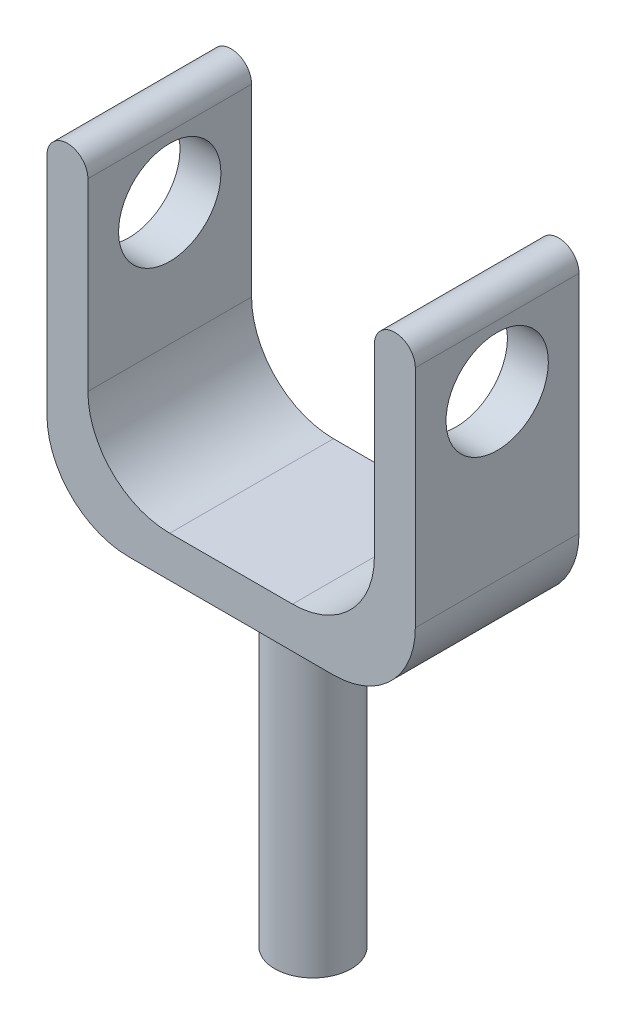
from build123d import *

# Parameters (mm, degrees)
BOSS_EXTRUDE1_DEPTH     = 20
SKETCH2_R               = 9.3485
BOSS_EXTRUDE2_DEPTH     = 80
FILLET1_R               = 20
CUT_EXTRUDE1_DEPTH      = 126.39936204
CUT_EXTRUDE1_DEPTH_BACK = 126.39936204
SKETCH3_R               = 12.5
SCALE1_SCALE            = 0.5


with BuildPart() as part:
    # Sketch1 → Boss-Extrude1 (new, symmetric)
    with BuildSketch(Plane.XY):
        with BuildLine():
            Line((35, 5), (35, 70))
            ThreePointArc((35, 70), (40, 75), (45, 70))
            Line((45, 70), (45, -5))
            Line((45, -5), (-45, -5))
            Line((-45, -5), (-45, 70))
            ThreePointArc((-45, 70), (-40, 75), (-35, 70))
            Line((-35, 70), (-35, 5))
            Line((-35, 5), (35, 5))
        make_face()
    extrude(amount=BOSS_EXTRUDE1_DEPTH, both=True)

    # Sketch2 → Boss-Extrude2 (add)
    with BuildSketch(Plane.XZ.offset(5)):
        with Locations(Location((0, 0, 0), (0, 0, 270))):
            Circle(SKETCH2_R)
    extrude(amount=BOSS_EXTRUDE2_DEPTH)

    # Fillet1
    fillet1_edges = [part.edges().sort_by_distance(p)[0] for p in [
        (35, 5, 0),
        (45, -5, 0),
        (-45, -5, 0),
        (-35, 5, 0),
    ]]
    fillet(fillet1_edges, radius=FILLET1_R)

    # Sketch3 → Cut-Extrude1 (cut, two sides: drawn at the far end of the back side and taken through both)
    with BuildSketch(Plane(origin=(45, 0, 0), x_dir=(0, 0, -1), z_dir=(1, 0, 0)).offset(-CUT_EXTRUDE1_DEPTH_BACK)):
        with Locations(Location((0, 55, 0), (0, 0, 90))):
            Circle(SKETCH3_R)
    extrude(amount=CUT_EXTRUDE1_DEPTH + CUT_EXTRUDE1_DEPTH_BACK, mode=Mode.SUBTRACT)


with BuildPart() as part_1:
    # Scale1: scaled about (0, 6.940558609, 0)
    add(part.part.scale(SCALE1_SCALE).moved(Location((0, 3.470279304, 0))))


solid = part_1.part
